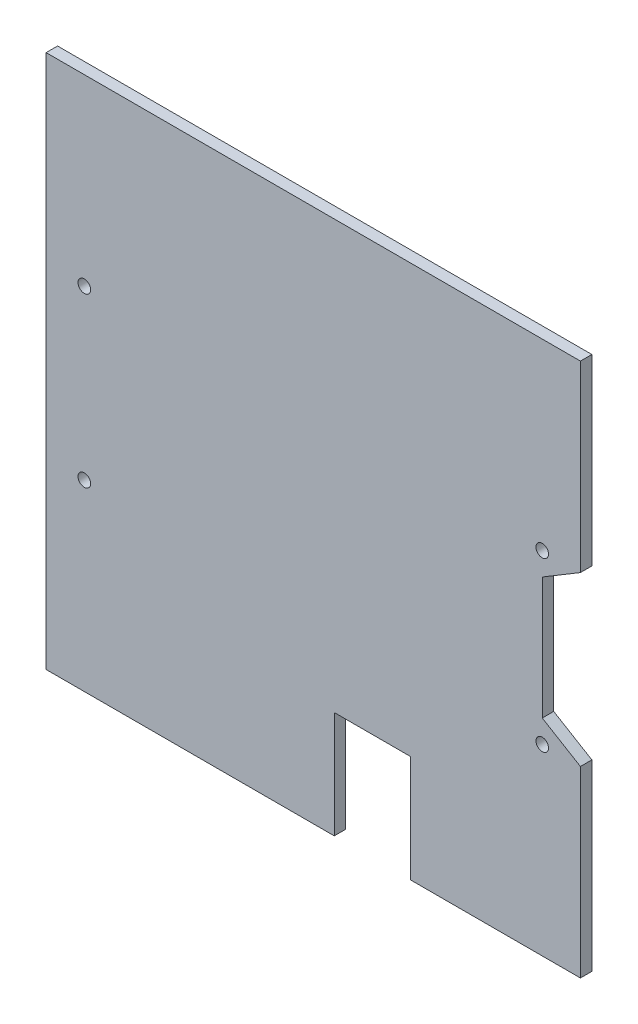
from build123d import *

# Parameters (mm, degrees)
SKETCH1_R           = 1.65
BOSS_EXTRUDE1_DEPTH = 3


with BuildPart() as part:
    # Sketch1 → Boss-Extrude1 (new body)
    with BuildSketch(Plane.XY):
        Polygon((0, -26), (75.5, -26), (75.5, 2), (95.5, 2), (95.5, -26), (140, -26), (140, 22), (130, 28), (130, 60), (140, 66), (140, 114), (0, 114), align=None)
        with Locations((10, 22)):
            Circle(SKETCH1_R, mode=Mode.SUBTRACT)
        with Locations(Location((130, 66, 0), (0, 0, 180))):
            Circle(SKETCH1_R, mode=Mode.SUBTRACT)
        with Locations((130, 22)):
            Circle(SKETCH1_R, mode=Mode.SUBTRACT)
        with Locations(Location((10, 66, 0), (0, 0, 180))):
            Circle(SKETCH1_R, mode=Mode.SUBTRACT)
    extrude(amount=BOSS_EXTRUDE1_DEPTH)


solid = part.part
